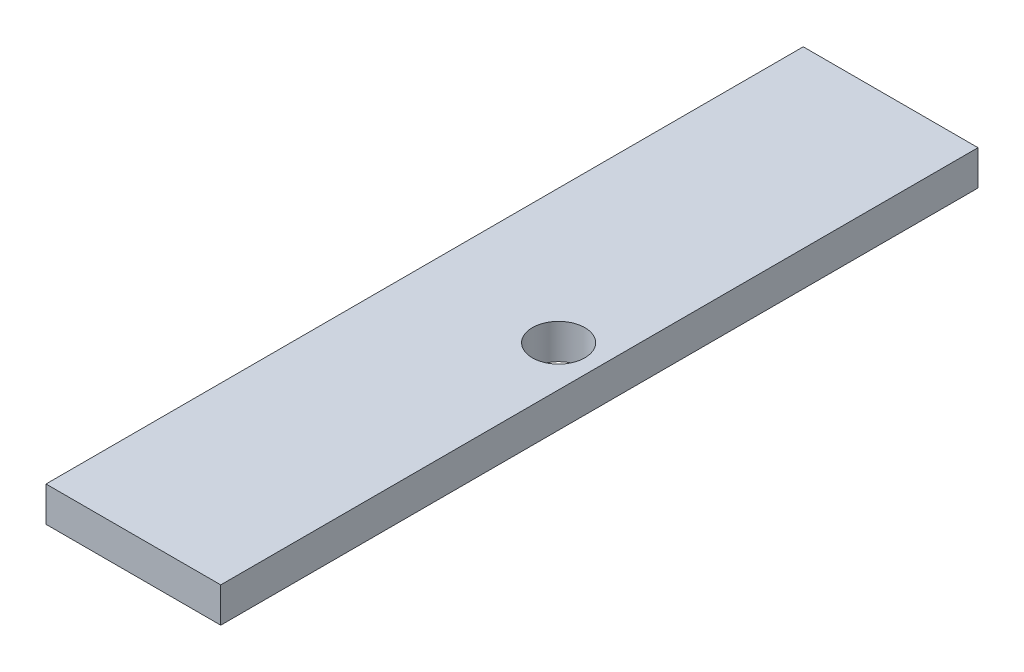
from build123d import *

# Parameters (mm, degrees)
SKIZZE1_W                       = 30
SKIZZE1_H                       = 6
AUFSATZ_LINEAR_AUSTRAGEN1_DEPTH = 65
CUT_EXTRUDE1_DEPTH              = 67.775744099
CUT_EXTRUDE1_DEPTH_BACK         = 67.775744099
SKETCH1_R                       = 4.5


with BuildPart() as part:
    # Skizze1 → Aufsatz-Linear austragen1 (new, symmetric)
    with BuildSketch(Plane.XY):
        Rectangle(SKIZZE1_W, SKIZZE1_H)
    extrude(amount=AUFSATZ_LINEAR_AUSTRAGEN1_DEPTH, both=True)

    # Sketch1 → Cut-Extrude1 (cut, two sides: drawn at the far end of the back side and taken through both)
    with BuildSketch(Plane(origin=(0, 0, 0), x_dir=(1, 0, 0), z_dir=(0, 1, 0)).offset(-CUT_EXTRUDE1_DEPTH_BACK)):
        with Locations(Location((8, 0, 0), (0, 0, 270))):
            Circle(SKETCH1_R)
    extrude(amount=CUT_EXTRUDE1_DEPTH + CUT_EXTRUDE1_DEPTH_BACK, mode=Mode.SUBTRACT)


solid = part.part
